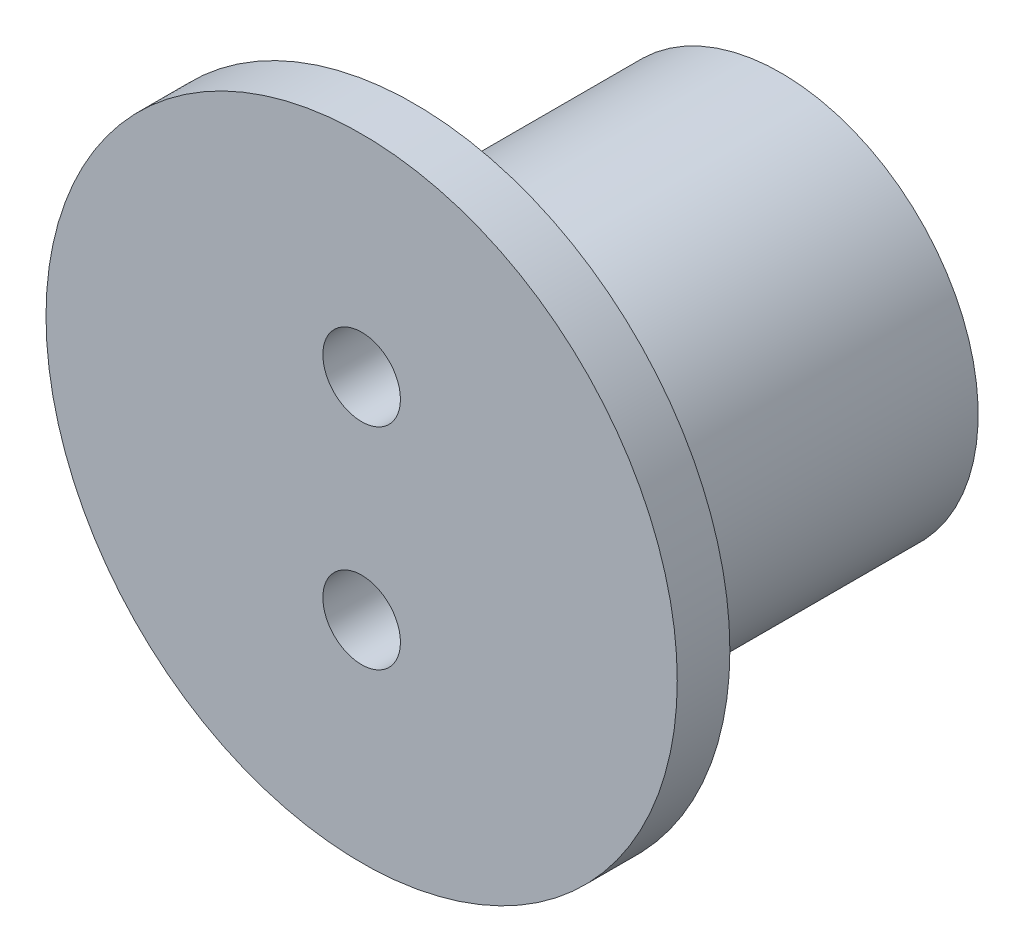
from build123d import *

# Parameters (mm, degrees)
SKETCH1_R           = 12
BOSS_EXTRUDE2_DEPTH = 2
SKETCH2_R           = 7.5
BOSS_EXTRUDE3_DEPTH = 12
SKETCH3_R           = 1.35
CUT_EXTRUDE2_DEPTH  = 23
SKETCH4_R           = 1.475
CUT_EXTRUDE4_DEPTH  = 18


with BuildPart() as part:
    # Sketch1 → Boss-Extrude2 (new body)
    with BuildSketch(Plane.XY):
        Circle(SKETCH1_R)
    extrude(amount=BOSS_EXTRUDE2_DEPTH)

    # Sketch2 → Boss-Extrude3 (add)
    with BuildSketch(Plane(origin=(0, 0, 0), x_dir=(-1, 0, 0), z_dir=(0, 0, -1))):
        with Locations((-1.940285, 0.48507125)):
            Circle(SKETCH2_R)
    extrude(amount=BOSS_EXTRUDE3_DEPTH)

    # Sketch3 → Cut-Extrude2 (cut, through all)
    with BuildSketch(Plane.XY.offset(2)):
        with Locations((0, 4)):
            Circle(SKETCH3_R)
        with Locations((0, -4)):
            Circle(SKETCH3_R)
    extrude(amount=-CUT_EXTRUDE2_DEPTH, mode=Mode.SUBTRACT)

    # Sketch4 → Cut-Extrude4 (cut)
    with BuildSketch(Plane.XY.offset(2)):
        with Locations((0, 4)):
            Circle(SKETCH4_R)
        with Locations((0, -4)):
            Circle(SKETCH4_R)
    extrude(amount=-CUT_EXTRUDE4_DEPTH, mode=Mode.SUBTRACT)


solid = part.part
